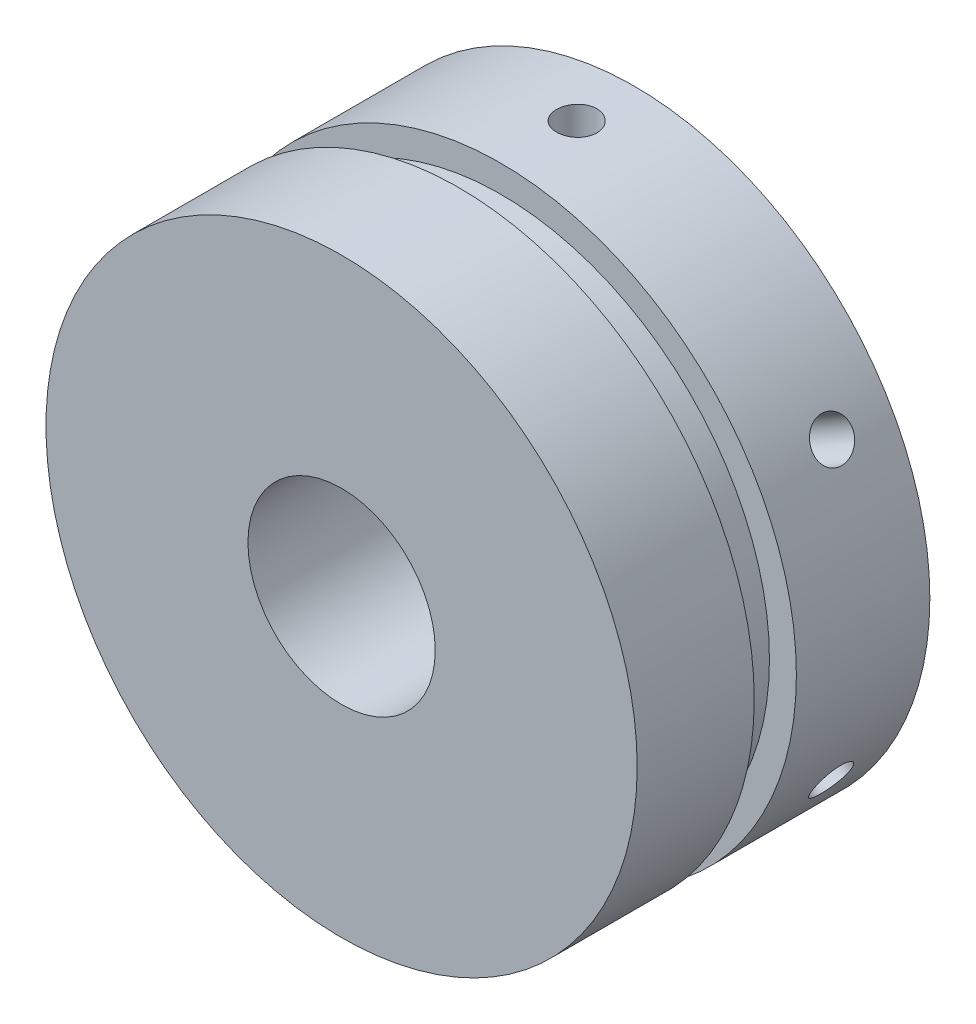
from build123d import *

# Parameters (mm, degrees)
SKETCH2_R           = 25.25
BOSS_EXTRUDE1_DEPTH = 25
SKETCH8_W           = 3.6
SKETCH8_H           = 2.3
CIRPATTERN1_COUNT   = 6


with BuildPart() as part:
    # Sketch2 → Boss-Extrude1 (new body)
    with BuildSketch(Plane.XY):
        Circle(SKETCH2_R)
    extrude(amount=BOSS_EXTRUDE1_DEPTH)

    # Sketch6 → Cut-Revolve2 (revolve, cut)
    with BuildSketch(Plane(origin=(0, 0, 0), x_dir=(0, 0, -1), z_dir=(1, 0, 0)), mode=Mode.PRIVATE) as cut_revolve2_sk:
        Polygon((-25, 0), (-25, 8), (-13.59, 8), (-9.799695483, 1.435), (0, 4.06), (0, 0), align=None)
    revolve(cut_revolve2_sk.sketch.rotate(Axis((0, 0, 0), (0, 0, 1)), 90), axis=Axis((0, 0, 0), (0, 0, 1)), mode=Mode.SUBTRACT)

    # Sketch8 → Cut-Revolve3 (revolve, cut)
    with BuildSketch(Plane(origin=(0, 0, 0), x_dir=(0, 0, -1), z_dir=(1, 0, 0)), mode=Mode.PRIVATE) as cut_revolve3_sk:
        with Locations((-13.2, 24.1)):
            Rectangle(SKETCH8_W, SKETCH8_H)
    revolve(cut_revolve3_sk.sketch.rotate(Axis((0, 0, 25), (0, 0, -1)), 90), axis=Axis((0, 0, 25), (0, 0, -1)), mode=Mode.SUBTRACT)

    # Sketch9 → #8-32 Tapped Hole1 (revolve, cut)
    with BuildSketch(Plane(origin=(0.079165003, 25.249875899, 5), x_dir=(-0.9999950850990496, 0.003135247636910079, 0), z_dir=(0, 0, 1))):
        Polygon((0, 0), (0, 11.037806461), (1.7272, 10), (1.7272, 0), align=None)
    f_8_32_tapped_hole1 = revolve(axis=Axis((0.099073825, 31.599844689, 5), (-0.0031352476369100784, -0.9999950850990494, 0)), mode=Mode.SUBTRACT)

    # CirPattern1: #8-32 Tapped Hole1 ×6 about axis
    cirpattern1_axis = Axis((0, 0, 25), (0, 0, -1))
    for i in range(1, CIRPATTERN1_COUNT):
        add(f_8_32_tapped_hole1.rotate(cirpattern1_axis, i * 360 / CIRPATTERN1_COUNT), mode=Mode.SUBTRACT)


solid = part.part
